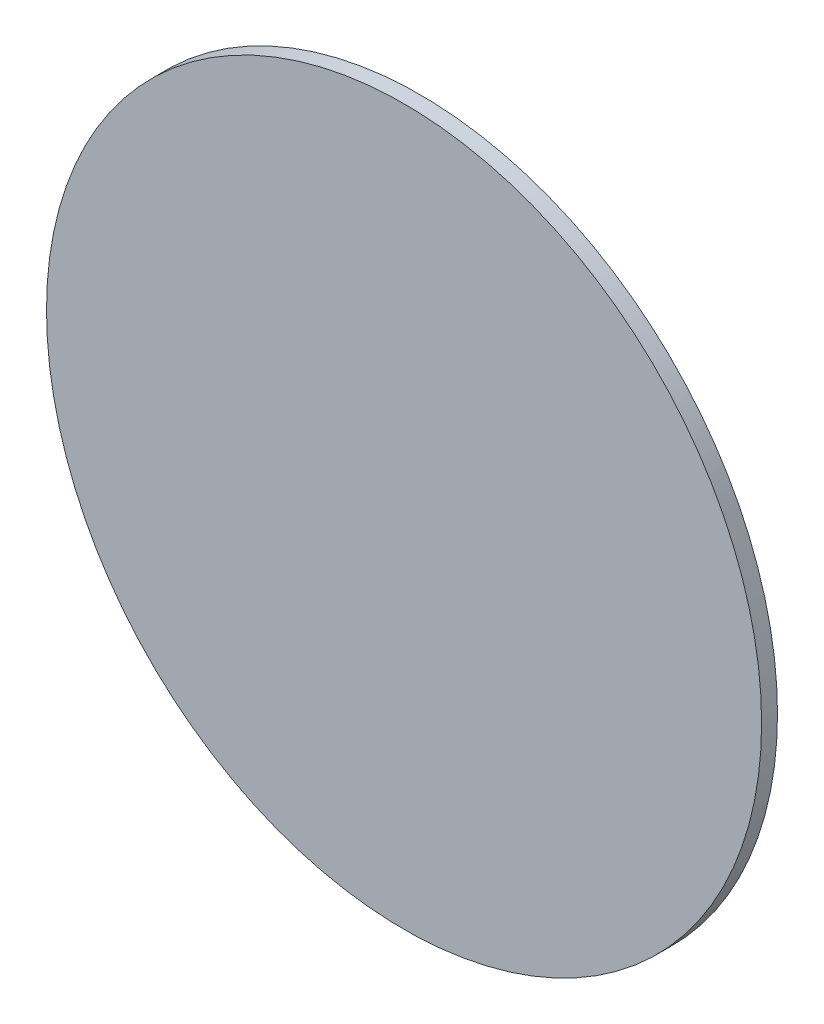
from build123d import *

# Parameters (mm, degrees)
SKETCH2_R           = 45
BOSS_EXTRUDE1_DEPTH = 2


with BuildPart() as part:
    # Sketch2 → Boss-Extrude1 (new body)
    with BuildSketch(Plane.XY):
        Circle(SKETCH2_R)
    extrude(amount=BOSS_EXTRUDE1_DEPTH)


solid = part.part
